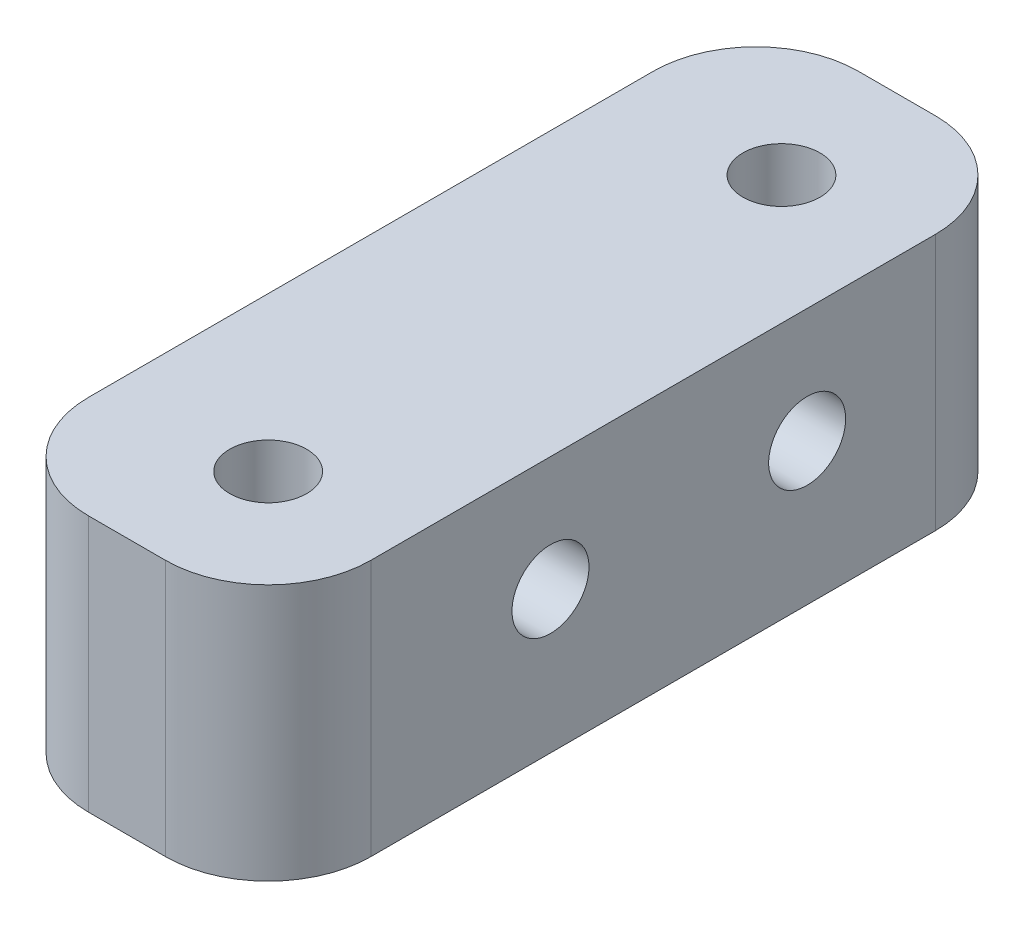
from build123d import *

# Parameters (mm, degrees)
SKETCH1_W           = 11
SKETCH1_H           = 30
SKETCH1_R           = 1.5
BOSS_EXTRUDE1_DEPTH = 10
SKETCH2_R           = 1.5
CUT_EXTRUDE1_DEPTH  = 34.481338086
FILLET1_R           = 4


with BuildPart() as part:
    # Sketch1 → Boss-Extrude1 (new body)
    with BuildSketch(Plane(origin=(0, 0, 0), x_dir=(1, 0, 0), z_dir=(0, 1, 0))):
        with Locations((5.5, 15)):
            Rectangle(SKETCH1_W, SKETCH1_H)
        with Locations(Location((6, 25, 0), (0, 0, 270))):
            Circle(SKETCH1_R, mode=Mode.SUBTRACT)
        with Locations(Location((6, 5, 0), (0, 0, 270))):
            Circle(SKETCH1_R, mode=Mode.SUBTRACT)
    extrude(amount=BOSS_EXTRUDE1_DEPTH)

    # Sketch2 → Cut-Extrude1 (cut, through all)
    with BuildSketch(Plane(origin=(11, 0, 0), x_dir=(0, 0, -1), z_dir=(1, 0, 0))):
        with Locations((11, 5.530453401)):
            Circle(SKETCH2_R)
        with Locations((21, 5.530453401)):
            Circle(SKETCH2_R)
    extrude(amount=-CUT_EXTRUDE1_DEPTH, mode=Mode.SUBTRACT)

    # Fillet1
    fillet1_edges = [part.edges().sort_by_distance(p)[0] for p in [
        (0, 5, -30),
        (11, 5, -30),
        (11, 5, 0),
        (0, 5, 0),
    ]]
    fillet(fillet1_edges, radius=FILLET1_R)


solid = part.part
